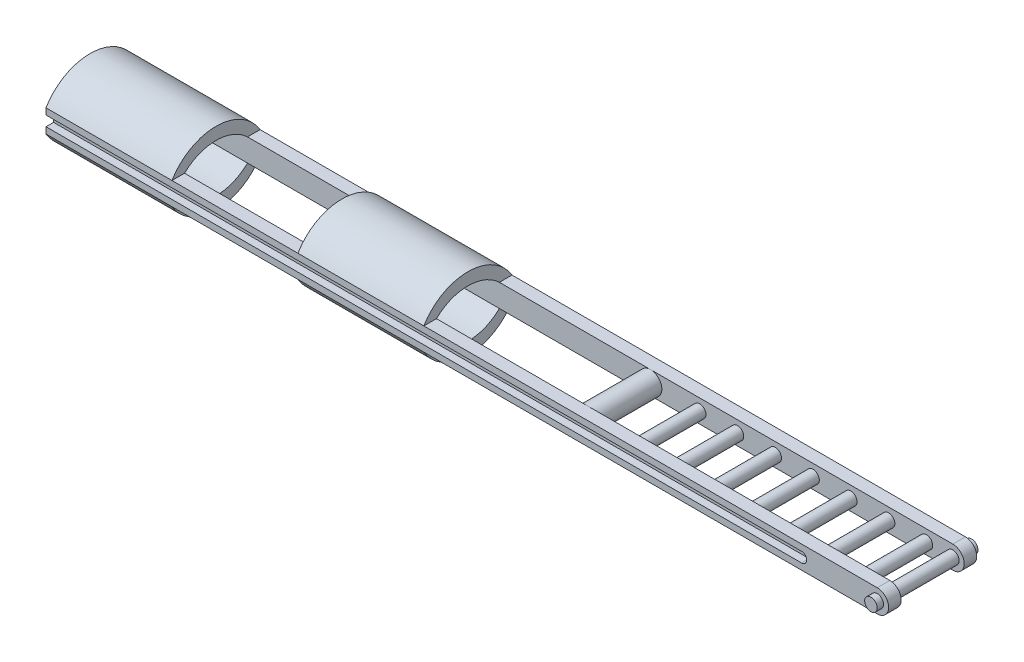
from build123d import *

# Parameters (mm, degrees)
CROQUIS1_R              = 4.5
SALIENTE_EXTRUIR1_DEPTH = 12.5
SALIENTE_EXTRUIR2_START = 5
SALIENTE_EXTRUIR2_DEPTH = 5
CROQUIS4_R              = 2.5
SALIENTE_EXTRUIR3_DEPTH = 20
CORTAR_EXTRUIR1_DEPTH   = 3
SALIENTE_EXTRUIR4_START = -5
SALIENTE_EXTRUIR4_DEPTH = 5
CROQUIS7_W              = 256.925453937
CROQUIS7_H              = 4
CORTAR_EXTRUIR2_DEPTH   = 10
SALIENTE_EXTRUIR6_DEPTH = 5
CROQUIS9_W              = 256.997943919
CROQUIS9_H              = 4
CORTAR_EXTRUIR3_DEPTH   = 10
CROQUIS10_R             = 2.5
SALIENTE_EXTRUIR7_DEPTH = 25
SALIENTE_EXTRUIR9_DEPTH = 50
MATRIZL1_COUNT          = 2
MATRIZL1_PITCH          = 100
MATRIZL1_COPY_1_DEPTH   = 50


with BuildPart() as part:
    # Croquis1 → Saliente-Extruir1 (new, symmetric)
    with BuildSketch(Plane.XY):
        Circle(CROQUIS1_R)
    extrude(amount=SALIENTE_EXTRUIR1_DEPTH, both=True)

    # Croquis2 → Saliente-Extruir2 (add)
    with BuildSketch(Plane.XY.offset(12.5).offset(SALIENTE_EXTRUIR2_START)):
        with BuildLine():
            Line((0, 4.5), (120, 4.5))
            ThreePointArc((120, 4.5), (124.5, 0), (120, -4.5))
            Line((120, -4.5), (0, -4.5))
            ThreePointArc((0, -4.5), (-4.5, 0), (0, 4.5))
        make_face()
    saliente_extruir2 = extrude(amount=-SALIENTE_EXTRUIR2_DEPTH)

    # Simetría1: Saliente-Extruir2 across plane
    add(saliente_extruir2.mirror(Plane.XY))

    # Croquis4 → Saliente-Extruir3 (add, symmetric)
    with BuildSketch(Plane.XY):
        with Locations(Location((120, 0, 0), (0, 0, 180))):
            Circle(CROQUIS4_R)
    extrude(amount=SALIENTE_EXTRUIR3_DEPTH, both=True)

    # Croquis5 → Cortar-Extruir1 (cut)
    with BuildSketch(Plane.XY.offset(17.5)):
        with BuildLine():
            Line((0, 2), (90, 2))
            ThreePointArc((90, 2), (92, 0), (90, -2))
            Line((90, -2), (0, -2))
            ThreePointArc((0, -2), (-2, 0), (0, 2))
        make_face()
    cortar_extruir1 = extrude(amount=-CORTAR_EXTRUIR1_DEPTH, mode=Mode.SUBTRACT)

    # Simetría2: Cortar-Extruir1 across plane
    add(cortar_extruir1.mirror(Plane.XY), mode=Mode.SUBTRACT)

    # Croquis6 → Saliente-Extruir4 (add)
    with BuildSketch(Plane(origin=(0, 0, -17.5), x_dir=(-1, 0, 0), z_dir=(0, 0, -1)).offset(SALIENTE_EXTRUIR4_START)):
        with BuildLine():
            Line((0, 4.5), (210, 4.5))
            Line((210, 4.5), (210, -4.5))
            Line((210, -4.5), (0, -4.5))
            ThreePointArc((0, -4.5), (4.5, 0), (0, 4.5))
        make_face()
    extrude(amount=SALIENTE_EXTRUIR4_DEPTH)

    # Croquis7 → Cortar-Extruir2 (cut)
    with BuildSketch(Plane(origin=(0, 0, -14.5), x_dir=(-1, 0, 0), z_dir=(0, 0, -1))):
        with Locations((128.462726969, 0)):
            Rectangle(CROQUIS7_W, CROQUIS7_H)
    extrude(amount=CORTAR_EXTRUIR2_DEPTH, mode=Mode.SUBTRACT)

    # Croquis8 → Saliente-Extruir6 (add)
    with BuildSketch(Plane.XY.offset(17.5)):
        with BuildLine():
            Line((0, 4.5), (-210, 4.5))
            Line((-210, 4.5), (-210, -4.5))
            Line((-210, -4.5), (0, -4.5))
            ThreePointArc((0, -4.5), (-4.5, 0), (0, 4.5))
        make_face()
    extrude(amount=-SALIENTE_EXTRUIR6_DEPTH)

    # Croquis9 → Cortar-Extruir3 (cut)
    with BuildSketch(Plane.XY.offset(14.5)):
        with Locations((-128.49897196, 0)):
            Rectangle(CROQUIS9_W, CROQUIS9_H)
    extrude(amount=CORTAR_EXTRUIR3_DEPTH, mode=Mode.SUBTRACT)

    # Croquis10 → Saliente-Extruir7 (add)
    with BuildSketch(Plane.XY.offset(-12.5)):
        with Locations(Location((109.5, 0, 0), (0, 0, 180))):
            Circle(CROQUIS10_R)
        with Locations(Location((94.5, 0, 0), (0, 0, 180))):
            Circle(CROQUIS10_R)
        with Locations(Location((79.5, 0, 0), (0, 0, 180))):
            Circle(CROQUIS10_R)
        with Locations(Location((64.5, 0, 0), (0, 0, 180))):
            Circle(CROQUIS10_R)
        with Locations(Location((49.5, 0, 0), (0, 0, 180))):
            Circle(CROQUIS10_R)
        with Locations(Location((34.5, 0, 0), (0, 0, 180))):
            Circle(CROQUIS10_R)
        with Locations(Location((19.5, 0, 0), (0, 0, 180))):
            Circle(CROQUIS10_R)
    extrude(amount=SALIENTE_EXTRUIR7_DEPTH)

    # Croquis13 → Saliente-Extruir9 (add)
    with BuildSketch(Plane.ZY.offset(210)):
        with BuildLine():
            Line((17.5, 4.5), (12.5, 4.5))
            ThreePointArc((12.5, 4.5), (0, 9.538029883), (-12.5, 4.5))
            Line((-12.5, 4.5), (-17.5, 4.5))
            ThreePointArc((-17.5, 4.5), (0, 14.414141438), (17.5, 4.5))
        make_face()
    saliente_extruir9 = extrude(amount=-SALIENTE_EXTRUIR9_DEPTH)

    # Simetría3: Saliente-Extruir9 across plane
    add(saliente_extruir9.mirror(Plane.ZX))

    # MatrizL1: Saliente-Extruir9 ×2
    with Locations(*[(i * MATRIZL1_PITCH, 0, 0) for i in range(1, MATRIZL1_COUNT)]):
        add(saliente_extruir9)

    # MatrizL1 copy 1 sketch → MatrizL1 copy 1 (add)
    with BuildSketch(Plane.ZY.offset(110)):
        with BuildLine():
            Line((17.5, -4.5), (12.5, -4.5))
            ThreePointArc((12.5, -4.5), (0, -9.538029883), (-12.5, -4.5))
            Line((-12.5, -4.5), (-17.5, -4.5))
            ThreePointArc((-17.5, -4.5), (0, -14.414141438), (17.5, -4.5))
        make_face()
    extrude(amount=-MATRIZL1_COPY_1_DEPTH)


solid = part.part
